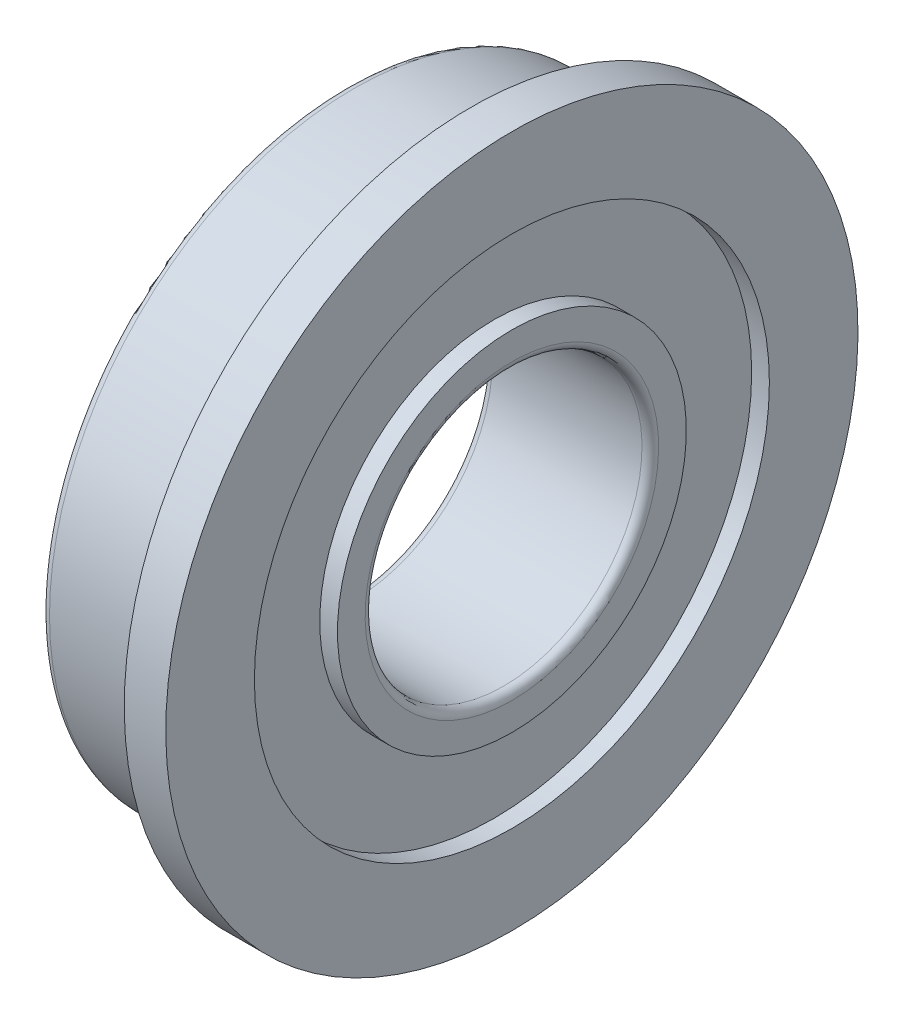
from build123d import *

# Parameters (mm, degrees)
FILLET1_R = 0.3


with BuildPart() as part:
    # Sketch1 → Revolve1 (revolve)
    with BuildSketch(Plane.XY, mode=Mode.PRIVATE) as revolve1_sk:
        with BuildLine():
            Line((0, 11.2), (0, 12.5))
            Line((0, 12.5), (1.5, 12.5))
            Line((1.5, 12.5), (1.5, 9.3))
            Line((1.5, 9.3), (0.86, 9.3))
            Line((0.86, 9.3), (0.86, 6.3))
            Line((0.86, 6.3), (1.5, 6.3))
            Line((1.5, 6.3), (1.5, 5))
            Line((1.5, 5), (-4.5, 5))
            Line((-4.5, 5), (-4.5, 6.3))
            Line((-4.5, 6.3), (-3.86, 6.3))
            Line((-3.86, 6.3), (-3.86, 9.3))
            Line((-3.86, 9.3), (-4.5, 9.3))
            Line((-4.5, 9.3), (-4.5, 11))
            Line((-4.5, 11), (-0.2, 11))
            ThreePointArc((-0.2, 11), (0.141421356, 10.858578644), (0, 11.2))
        make_face()
    revolve(revolve1_sk.sketch.rotate(Axis((-4.5, 0, 0), (1, 0, 0)), 180), axis=Axis((-4.5, 0, 0), (1, 0, 0)))

    # Fillet1
    fillet1_edges = [part.edges().sort_by_distance(p)[0] for p in [
        (1.5, 5, 0),
        (-4.5, 5, 0),
        (-4.5, 11, 0),
    ]]
    fillet(fillet1_edges, radius=FILLET1_R)


solid = part.part
